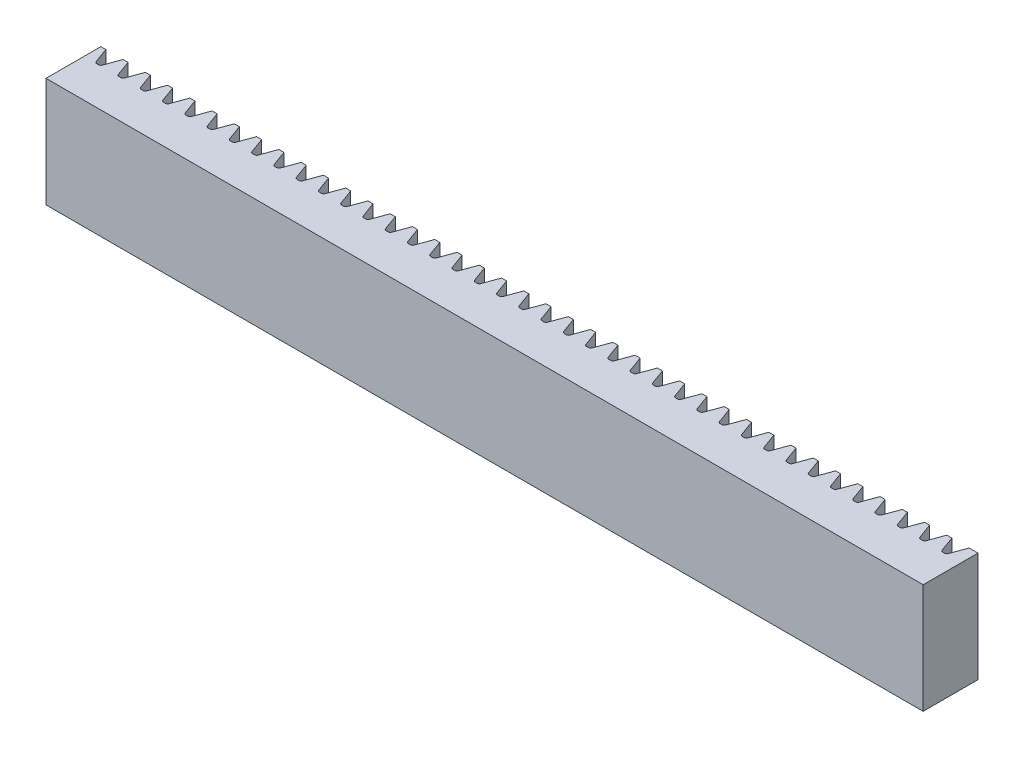
from build123d import *

# Parameters (mm, degrees)
BOSS_EXTRUDE1_DEPTH = 15
FILLET1_R           = 0.3


with BuildPart() as part:
    # Sketch1 → Boss-Extrude1 (new body)
    with BuildSketch(Plane(origin=(0, 0, 0), x_dir=(1, 0, 0), z_dir=(0, 1, 0))):
        Polygon((0, 0), (120, 0), (120, 7.5), (118.788660027, 7.5), (117.951528489, 5.2), (117.265728489, 5.2), (116.42859695, 7.5), (115.74279695, 7.5), (114.905665411, 5.2), (114.219865411, 5.2), (113.382733872, 7.5), (112.696933872, 7.5), (111.859802333, 5.2), (111.174002333, 5.2), (110.336870794, 7.5), (109.651070794, 7.5), (108.813939256, 5.2), (108.128139256, 5.2), (107.291007717, 7.5), (106.605207717, 7.5), (105.768076178, 5.2), (105.082276178, 5.2), (104.245144639, 7.5), (103.559344639, 7.5), (102.7222131, 5.2), (102.0364131, 5.2), (101.199281562, 7.5), (100.513481562, 7.5), (99.676350023, 5.2), (98.990550023, 5.2), (98.153418484, 7.5), (97.467618484, 7.5), (96.630486945, 5.2), (95.944686945, 5.2), (95.107555406, 7.5), (94.421755406, 7.5), (93.584623868, 5.2), (92.898823868, 5.2), (92.061692329, 7.5), (91.375892329, 7.5), (90.53876079, 5.2), (89.85296079, 5.2), (89.015829251, 7.5), (88.330029251, 7.5), (87.492897712, 5.2), (86.807097712, 5.2), (85.969966173, 7.5), (85.284166173, 7.5), (84.447034635, 5.2), (83.761234635, 5.2), (82.924103096, 7.5), (82.238303096, 7.5), (81.401171557, 5.2), (80.715371557, 5.2), (79.878240018, 7.5), (79.192440018, 7.5), (78.355308479, 5.2), (77.669508479, 5.2), (76.832376941, 7.5), (76.146576941, 7.5), (75.309445402, 5.2), (74.623645402, 5.2), (73.786513863, 7.5), (73.100713863, 7.5), (72.263582324, 5.2), (71.577782324, 5.2), (70.740650785, 7.5), (70.054850785, 7.5), (69.217719247, 5.2), (68.531919247, 5.2), (67.694787708, 7.5), (67.008987708, 7.5), (66.171856169, 5.2), (65.486056169, 5.2), (64.64892463, 7.5), (63.96312463, 7.5), (63.125993091, 5.2), (62.440193091, 5.2), (61.603061552, 7.5), (60.917261552, 7.5), (60.080130014, 5.2), (59.394330014, 5.2), (58.557198475, 7.5), (57.871398475, 7.5), (57.034266936, 5.2), (56.348466936, 5.2), (55.511335397, 7.5), (54.825535397, 7.5), (53.988403858, 5.2), (53.302603858, 5.2), (52.46547232, 7.5), (51.77967232, 7.5), (50.942540781, 5.2), (50.256740781, 5.2), (49.419609242, 7.5), (48.733809242, 7.5), (47.896677703, 5.2), (47.210877703, 5.2), (46.373746164, 7.5), (45.687946164, 7.5), (44.850814626, 5.2), (44.165014626, 5.2), (43.327883087, 7.5), (42.642083087, 7.5), (41.804951548, 5.2), (41.119151548, 5.2), (40.282020009, 7.5), (39.596220009, 7.5), (38.75908847, 5.2), (38.07328847, 5.2), (37.236156931, 7.5), (36.550356931, 7.5), (35.713225393, 5.2), (35.027425393, 5.2), (34.190293854, 7.5), (33.504493854, 7.5), (32.667362315, 5.2), (31.981562315, 5.2), (31.144430776, 7.5), (30.458630776, 7.5), (29.621499237, 5.2), (28.935699237, 5.2), (28.098567699, 7.5), (27.412767699, 7.5), (26.57563616, 5.2), (25.88983616, 5.2), (25.052704621, 7.5), (24.366904621, 7.5), (23.529773082, 5.2), (22.843973082, 5.2), (22.006841543, 7.5), (21.321041543, 7.5), (20.483910005, 5.2), (19.798110005, 5.2), (18.960978466, 7.5), (18.275178466, 7.5), (17.438046927, 5.2), (16.752246927, 5.2), (15.915115388, 7.5), (15.229315388, 7.5), (14.392183849, 5.2), (13.706383849, 5.2), (12.86925231, 7.5), (12.18345231, 7.5), (11.346320772, 5.2), (10.660520772, 5.2), (9.823389233, 7.5), (9.137589233, 7.5), (8.300457694, 5.2), (7.614657694, 5.2), (6.777526155, 7.5), (6.091726155, 7.5), (5.254594616, 5.2), (4.568794616, 5.2), (3.731663078, 7.5), (3.045863078, 7.5), (2.208731539, 5.2), (1.522931539, 5.2), (0.6858, 7.5), (0, 7.5), align=None)
    extrude(amount=BOSS_EXTRUDE1_DEPTH)

    # Fillet1
    fillet1_edges = [part.edges().sort_by_distance(p)[0] for p in [
        (1.522931539, 7.5, -5.2),
        (2.208731539, 7.5, -5.2),
        (4.568794616, 7.5, -5.2),
        (5.254594616, 7.5, -5.2),
        (7.614657694, 7.5, -5.2),
        (8.300457694, 7.5, -5.2),
        (10.660520772, 7.5, -5.2),
        (11.346320772, 7.5, -5.2),
        (13.706383849, 7.5, -5.2),
        (14.392183849, 7.5, -5.2),
        (16.752246927, 7.5, -5.2),
        (17.438046927, 7.5, -5.2),
        (19.798110005, 7.5, -5.2),
        (20.483910005, 7.5, -5.2),
        (22.843973082, 7.5, -5.2),
        (23.529773082, 7.5, -5.2),
        (25.88983616, 7.5, -5.2),
        (26.57563616, 7.5, -5.2),
        (28.935699237, 7.5, -5.2),
        (29.621499237, 7.5, -5.2),
        (31.981562315, 7.5, -5.2),
        (32.667362315, 7.5, -5.2),
        (35.027425393, 7.5, -5.2),
        (35.713225393, 7.5, -5.2),
        (38.07328847, 7.5, -5.2),
        (38.75908847, 7.5, -5.2),
        (41.119151548, 7.5, -5.2),
        (41.804951548, 7.5, -5.2),
        (44.165014626, 7.5, -5.2),
        (44.850814626, 7.5, -5.2),
        (47.210877703, 7.5, -5.2),
        (47.896677703, 7.5, -5.2),
        (50.256740781, 7.5, -5.2),
        (50.942540781, 7.5, -5.2),
        (53.302603858, 7.5, -5.2),
        (53.988403858, 7.5, -5.2),
        (56.348466936, 7.5, -5.2),
        (57.034266936, 7.5, -5.2),
        (59.394330014, 7.5, -5.2),
        (60.080130014, 7.5, -5.2),
        (62.440193091, 7.5, -5.2),
        (63.125993091, 7.5, -5.2),
        (65.486056169, 7.5, -5.2),
        (66.171856169, 7.5, -5.2),
        (68.531919247, 7.5, -5.2),
        (69.217719247, 7.5, -5.2),
        (71.577782324, 7.5, -5.2),
        (72.263582324, 7.5, -5.2),
        (74.623645402, 7.5, -5.2),
        (75.309445402, 7.5, -5.2),
        (77.669508479, 7.5, -5.2),
        (78.355308479, 7.5, -5.2),
        (80.715371557, 7.5, -5.2),
        (81.401171557, 7.5, -5.2),
        (83.761234635, 7.5, -5.2),
        (84.447034635, 7.5, -5.2),
        (86.807097712, 7.5, -5.2),
        (87.492897712, 7.5, -5.2),
        (89.85296079, 7.5, -5.2),
        (90.53876079, 7.5, -5.2),
        (92.898823868, 7.5, -5.2),
        (93.584623868, 7.5, -5.2),
        (95.944686945, 7.5, -5.2),
        (96.630486945, 7.5, -5.2),
        (98.990550023, 7.5, -5.2),
        (99.676350023, 7.5, -5.2),
        (102.0364131, 7.5, -5.2),
        (102.7222131, 7.5, -5.2),
        (105.082276178, 7.5, -5.2),
        (105.768076178, 7.5, -5.2),
        (108.128139256, 7.5, -5.2),
        (108.813939256, 7.5, -5.2),
        (111.174002333, 7.5, -5.2),
        (111.859802333, 7.5, -5.2),
        (114.219865411, 7.5, -5.2),
        (114.905665411, 7.5, -5.2),
        (117.265728489, 7.5, -5.2),
        (117.951528489, 7.5, -5.2),
    ]]
    fillet(fillet1_edges, radius=FILLET1_R)


solid = part.part
